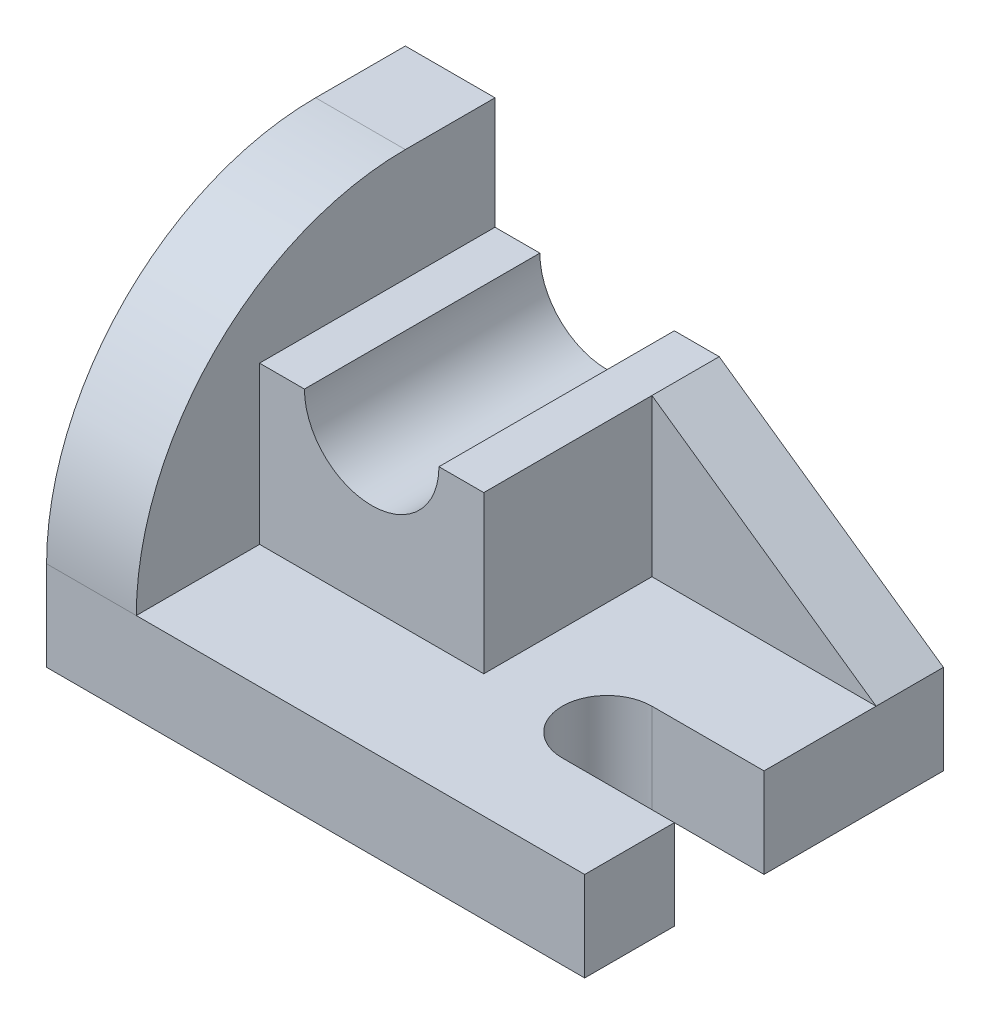
from build123d import *

# Parameters (mm, degrees)
SKETCH1_W           = 96
SKETCH1_H           = 64
BOSS_EXTRUDE1_DEPTH = 16
CUT_EXTRUDE1_DEPTH  = 16
BOSS_EXTRUDE2_DEPTH = 16
SKETCH4_W           = 40
SKETCH4_H           = 42
BOSS_EXTRUDE3_DEPTH = 28
SKETCH5_R           = 12
CUT_EXTRUDE3_DEPTH  = 46
BOSS_EXTRUDE4_DEPTH = 12


with BuildPart() as part:
    # Sketch1 → Boss-Extrude1 (new body)
    with BuildSketch(Plane(origin=(0, 0, 0), x_dir=(1, 0, 0), z_dir=(0, 1, 0))):
        with Locations((48, 32)):
            Rectangle(SKETCH1_W, SKETCH1_H)
    extrude(amount=BOSS_EXTRUDE1_DEPTH)

    # Sketch2 → Cut-Extrude1 (cut)
    with BuildSketch(Plane(origin=(0, 16, 0), x_dir=(1, 0, 0), z_dir=(0, 1, 0))):
        with BuildLine():
            Line((96, 16), (76, 16))
            ThreePointArc((76, 16), (68, 24), (76, 32))
            Line((76, 32), (96, 32))
            ThreePointArc((96, 32), (104, 24), (96, 16))
        make_face()
    extrude(amount=-CUT_EXTRUDE1_DEPTH, mode=Mode.SUBTRACT)

    # Sketch3 → Boss-Extrude2 (add)
    with BuildSketch(Plane.ZY):
        with BuildLine():
            Line((-64, 0), (0, 0))
            Line((0, 0), (0, 16))
            ThreePointArc((0, 16), (-14.058874503, 49.941125497), (-48, 64))
            Line((-48, 64), (-64, 64))
            Line((-64, 64), (-64, 0))
        make_face()
    extrude(amount=-BOSS_EXTRUDE2_DEPTH)

    # Sketch4 → Boss-Extrude3 (add)
    with BuildSketch(Plane(origin=(0, 16, 0), x_dir=(1, 0, 0), z_dir=(0, 1, 0))):
        with Locations((36, 43)):
            Rectangle(SKETCH4_W, SKETCH4_H)
    extrude(amount=BOSS_EXTRUDE3_DEPTH)

    # Sketch5 → Cut-Extrude3 (cut)
    with BuildSketch(Plane.XY.offset(-22)):
        with Locations((36, 44)):
            Circle(SKETCH5_R)
    extrude(amount=-CUT_EXTRUDE3_DEPTH, mode=Mode.SUBTRACT)

    # Sketch8 → Boss-Extrude4 (add)
    with BuildSketch(Plane(origin=(0, 0, -64), x_dir=(-1, 0, 0), z_dir=(0, 0, -1))):
        Polygon((-56, 44), (-96, 16), (-56, 16), align=None)
    extrude(amount=-BOSS_EXTRUDE4_DEPTH)


solid = part.part
